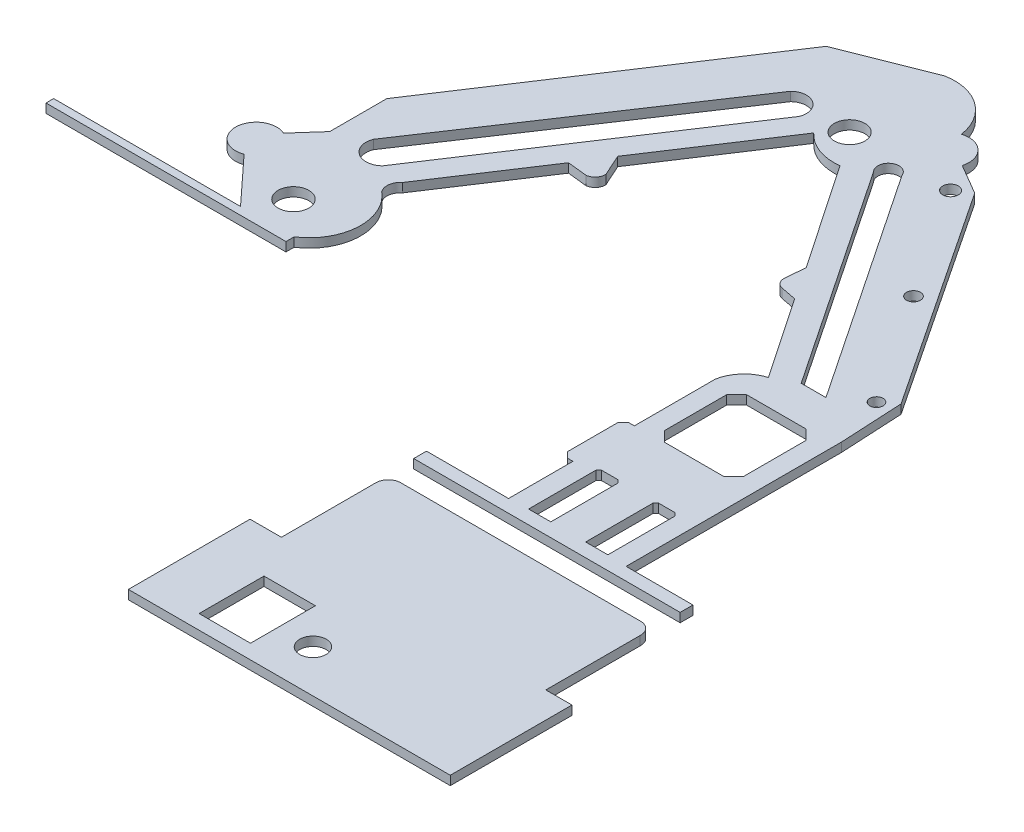
from build123d import *

# Parameters (mm, degrees)
SKETCH4_R             = 0.750267771
SKETCH4_R_2           = 0.265378854
SKETCH4_R_3           = 0.744648083
SKETCH4_R_4           = 0.32969998
SKETCH4_R_5           = 0.283853506
BOSS_EXTRUDE1_DEPTH   = 0.5
SKETCH4_R_6           = 0.632780779
SKETCH4_W             = 2.64350155
SKETCH4_H             = 3.390658061
BOSS_EXTRUDE1_2_DEPTH = 0.5
CUT_EXTRUDE2_START    = -10
CUT_EXTRUDE2_DEPTH    = 10
CUT_EXTRUDE3_START    = -10
SKETCH6_R             = 0.732780779
SKETCH6_R_2           = 0.632780779
SKETCH6_R_3           = 0.850267771
SKETCH6_R_4           = 0.750267771
SKETCH6_R_5           = 0.844648083
SKETCH6_R_6           = 0.744648083
SKETCH6_R_7           = 0.42969998
SKETCH6_R_8           = 0.32969998
SKETCH6_R_9           = 0.365378854
SKETCH6_R_10          = 0.265378854
SKETCH6_W             = 2.84350155
SKETCH6_H             = 3.590658061
SKETCH6_W_2           = 2.64350155
SKETCH6_H_2           = 3.390658061
SKETCH6_R_11          = 0.383853506
SKETCH6_R_12          = 0.283853506
CUT_EXTRUDE3_DEPTH    = 10


with BuildPart() as part:
    # Sketch4 → Boss-Extrude1 (new body)
    with BuildSketch(Plane(origin=(0, 0, 0), x_dir=(1, 0, 0), z_dir=(0, 1, 0))):
        with BuildLine():
            Line((-11.696283574, -2.014082393), (-21.838660036, -2.014082393))
            Line((-21.838660036, -2.014082393), (-21.838660036, -2.737299418))
            Line((-21.838660036, -2.737299418), (-8.267641282, -2.737299418))
            Line((-8.267641282, -2.737299418), (-8.267641282, -2.216070709))
            ThreePointArc((-8.267641282, -2.216070709), (-6.9710726, 0.108801001), (-8.041746829, 2.545966467))
            ThreePointArc((-8.041746829, 2.545966467), (-8.144633072, 2.982775881), (-7.908513733, 3.364398341))
            Line((-7.908513733, 3.364398341), (-4.305242174, 8.839733186))
            Line((-4.305242174, 8.839733186), (-3.299405457, 8.732581616))
            ThreePointArc((-3.299405457, 8.732581616), (-2.807647773, 8.98755206), (-2.639809989, 9.515440329))
            Line((-2.639809989, 9.515440329), (-3.155299637, 10.657283488))
            Line((-3.155299637, 10.657283488), (0.999182594, 16.970207993))
            ThreePointArc((0.999182594, 16.970207993), (2.017035083, 16.351359893), (3.199096829, 16.203960132))
            Line((3.199096829, 16.203960132), (7.062416262, 10.510667533))
            Line((7.062416262, 10.510667533), (6.986470802, 9.529316973))
            ThreePointArc((6.986470802, 9.529316973), (7.088909536, 9.032904845), (7.512361042, 8.754323587))
            Line((7.512361042, 8.754323587), (8.297542954, 8.603970949))
            Line((8.297542954, 8.603970949), (11.203908829, 4.320920683))
            ThreePointArc((11.203908829, 4.320920683), (10.34420923, 3.685817641), (9.894897145, 2.715993984))
            Line((9.894897145, 2.715993984), (9.894897145, -1.633176582))
            Line((9.894897145, -1.633176582), (9.665577443, -1.633176582))
            Line((9.665577443, -1.633176582), (9.280761035, -1.988912184))
            Line((9.280761035, -1.988912184), (9.280761035, -4.912831705))
            Line((9.280761035, -4.912831705), (9.665577443, -5.329106227))
            Line((9.665577443, -5.329106227), (9.894897145, -5.329106227))
            Line((9.894897145, -5.329106227), (9.894897145, -8.590016683))
            Line((9.894897145, -8.590016683), (5.357513848, -8.590016683))
            Line((5.357513848, -8.590016683), (5.357513848, -9.598509545))
            Line((5.357513848, -9.598509545), (20.394810246, -9.598509545))
            Line((20.394810246, -9.598509545), (20.394810246, -8.590016683))
            Line((20.394810246, -8.590016683), (16.696957273, -8.590016683))
            Line((16.696957273, -8.590016683), (16.696957273, 3.188629617))
            Line((16.696957273, 3.188629617), (16.513647646, 6.695111796))
            Line((16.513647646, 6.695111796), (8.419413526, 18.886774693))
            Line((8.419413526, 18.886774693), (6.813548497, 19.827890477))
            ThreePointArc((6.813548497, 19.827890477), (6.445780879, 21.035174164), (5.24174765, 21.413447748))
            ThreePointArc((5.24174765, 21.413447748), (3.999308004, 23.267073464), (1.810059191, 23.699247279))
            Line((1.810059191, 23.699247279), (-2.930027074, 21.821131787))
            Line((-2.930027074, 21.821131787), (-12.623890047, 7.090866568))
            Line((-12.623890047, 7.090866568), (-12.623890047, 3.94718675))
            Line((-12.623890047, 3.94718675), (-13.717599439, 2.715993984))
            ThreePointArc((-13.717599439, 2.715993984), (-15.442222206, 1.544355583), (-13.799219853, 0.2607655))
            Line((-13.799219853, 0.2607655), (-11.696283574, -2.014082393))
        make_face()
        Polygon((15.387945589, -5.012831705), (15.387945589, -8.590016683), (14.359515417, -8.590016683), (14.359515417, -5.012831705), (14.459515417, -4.912831705), (15.287945589, -4.912831705), align=None, mode=Mode.SUBTRACT)
        Polygon((12.232339001, -5.012831705), (12.232339001, -8.590016683), (11.203908829, -8.590016683), (11.203908829, -5.012831705), (11.303908829, -4.912831705), (12.132339001, -4.912831705), align=None, mode=Mode.SUBTRACT)
        with Locations(Location((-10.238001202, -0.352181677, 0), (0, 0, 270))):
            Circle(SKETCH4_R, mode=Mode.SUBTRACT)
        with BuildLine():
            ThreePointArc((-9.448675298, 3.772911532), (-10.488171503, 3.68816485), (-10.80864856, 4.68065103))
            Line((-10.80864856, 4.68065103), (-1.58551386, 18.498730584))
            ThreePointArc((-1.58551386, 18.498730584), (-0.602864551, 18.586331432), (-0.306829257, 17.645248717))
            Line((-0.306829257, 17.645248717), (-9.448675298, 3.772911532))
        make_face(mode=Mode.SUBTRACT)
        with BuildLine():
            Line((12.672348148, 4.971230017), (4.572305297, 17.059398095))
            ThreePointArc((4.572305297, 17.059398095), (4.638532997, 17.816162349), (5.357513848, 17.570918019))
            Line((5.357513848, 17.570918019), (13.800316104, 4.971230017))
            Line((13.800316104, 4.971230017), (12.672348148, 4.971230017))
        make_face(mode=Mode.SUBTRACT)
        Polygon((14.887945589, 2.715993984), (15.387945589, 2.215993984), (15.387945589, -1.133176582), (14.887945589, -1.633176582), (11.703908829, -1.633176582), (11.203908829, -1.133176582), (11.203908829, 2.215993984), (11.703908829, 2.715993984), align=None, mode=Mode.SUBTRACT)
        with Locations(Location((15.603207878, 6.050507476, 0), (0, 0, 270))):
            Circle(SKETCH4_R_2, mode=Mode.SUBTRACT)
        with Locations(Location((1.931063129, 18.237068392, 0), (0, 0, 270))):
            Circle(SKETCH4_R_3, mode=Mode.SUBTRACT)
        with Locations(Location((7.512361042, 18.237068392, 0), (0, 0, 270))):
            Circle(SKETCH4_R_4, mode=Mode.SUBTRACT)
        with Locations(Location((11.55778446, 12.143787934, 0), (0, 0, 270))):
            Circle(SKETCH4_R_5, mode=Mode.SUBTRACT)
    extrude(amount=BOSS_EXTRUDE1_DEPTH)


with BuildPart() as body_2:
    # Sketch4 → Boss-Extrude1 2 (new body)
    with BuildSketch(Plane(origin=(0, 0, 0), x_dir=(1, 0, 0), z_dir=(0, 1, 0))):
        with BuildLine():
            Line((19.613108594, -10.815832828), (6.267197301, -10.815832828))
            ThreePointArc((6.267197301, -10.815832828), (5.68414714, -11.098078534), (5.47144627, -11.70993511))
            Line((5.47144627, -11.70993511), (5.47144627, -16.728123553))
            Line((5.47144627, -16.728123553), (3.736597162, -16.728123553))
            Line((3.736597162, -16.728123553), (3.736597162, -23.756096292))
            Line((3.736597162, -23.756096292), (21.838660036, -23.756096292))
            Line((21.838660036, -23.756096292), (21.838660036, -16.728123553))
            Line((21.838660036, -16.728123553), (20.394183639, -16.728123553))
            Line((20.394183639, -16.728123553), (20.394183639, -11.660759485))
            ThreePointArc((20.394183639, -11.660759485), (20.178636157, -11.076530218), (19.613108594, -10.815832828))
        make_face()
        with Locations(Location((11.741164301, -21.25357645, 0), (0, 0, 270))):
            Circle(SKETCH4_R_6, mode=Mode.SUBTRACT)
        with Locations((8.419413526, -21.012384273)):
            Rectangle(SKETCH4_W, SKETCH4_H, mode=Mode.SUBTRACT)
    extrude(amount=BOSS_EXTRUDE1_2_DEPTH)


with BuildPart() as cut_extrude2_tool:
    # Sketch5 → Cut-Extrude2 (new body)
    # profile 1 of 2: a face of its own
    with BuildSketch(Plane(origin=(0, 0.5, 0), x_dir=(1, 0, 0), z_dir=(0, 1, 0)).offset(CUT_EXTRUDE2_START)):
        with BuildLine():
            Line((20.394183639, -16.728123553), (20.394183639, -11.660759485))
            ThreePointArc((20.394183639, -11.660759485), (20.178636157, -11.076530218), (19.613108594, -10.815832828))
            Line((19.613108594, -10.815832828), (6.267197301, -10.815832828))
            ThreePointArc((6.267197301, -10.815832828), (5.68414714, -11.098078534), (5.47144627, -11.70993511))
            Line((5.47144627, -11.70993511), (5.47144627, -16.728123553))
            Line((5.47144627, -16.728123553), (3.736597162, -16.728123553))
            Line((3.736597162, -16.728123553), (3.736597162, -23.756096292))
            Line((3.736597162, -23.756096292), (21.838660036, -23.756096292))
            Line((21.838660036, -23.756096292), (21.838660036, -16.728123553))
            Line((21.838660036, -16.728123553), (20.394183639, -16.728123553))
        make_face()
        with BuildLine():
            Line((20.244183639, -16.878123553), (20.244183639, -11.657665517))
            ThreePointArc((20.244183639, -11.657665517), (20.070382374, -11.18040847), (19.610014627, -10.965832828))
            Line((19.610014627, -10.965832828), (6.271771424, -10.965832828))
            ThreePointArc((6.271771424, -10.965832828), (5.79344755, -11.200910159), (5.62144627, -11.705360988))
            Line((5.62144627, -11.705360988), (5.62144627, -16.878123553))
            Line((5.62144627, -16.878123553), (3.886597162, -16.878123553))
            Line((3.886597162, -16.878123553), (3.886597162, -23.606096292))
            Line((3.886597162, -23.606096292), (21.688660036, -23.606096292))
            Line((21.688660036, -23.606096292), (21.688660036, -16.878123553))
            Line((21.688660036, -16.878123553), (20.244183639, -16.878123553))
        make_face(mode=Mode.SUBTRACT)
    # profile 2 of 2: a face of its own
    with BuildSketch(Plane(origin=(0, 0.5, 0), x_dir=(1, 0, 0), z_dir=(0, 1, 0)).offset(CUT_EXTRUDE2_START)):
        with BuildLine():
            Line((9.894897145, -5.329106227), (9.894897145, -8.590016683))
            Line((9.894897145, -8.590016683), (5.357513848, -8.590016683))
            Line((5.357513848, -8.590016683), (5.357513848, -9.598509545))
            Line((5.357513848, -9.598509545), (20.394810246, -9.598509545))
            Line((20.394810246, -9.598509545), (20.394810246, -8.590016683))
            Line((20.394810246, -8.590016683), (16.696957273, -8.590016683))
            Line((16.696957273, -8.590016683), (16.696957273, 3.188629617))
            Line((16.696957273, 3.188629617), (16.513647646, 6.695111796))
            Line((16.513647646, 6.695111796), (8.419413526, 18.886774693))
            Line((8.419413526, 18.886774693), (6.813548497, 19.827890477))
            ThreePointArc((6.813548497, 19.827890477), (6.445780879, 21.035174164), (5.24174765, 21.413447748))
            ThreePointArc((5.24174765, 21.413447748), (3.999308004, 23.267073464), (1.810059191, 23.699247279))
            Line((1.810059191, 23.699247279), (-2.930027074, 21.821131787))
            Line((-2.930027074, 21.821131787), (-12.623890047, 7.090866568))
            Line((-12.623890047, 7.090866568), (-12.623890047, 3.94718675))
            Line((-12.623890047, 3.94718675), (-13.717599439, 2.715993984))
            ThreePointArc((-13.717599439, 2.715993984), (-15.442222206, 1.544355583), (-13.799219853, 0.2607655))
            Line((-13.799219853, 0.2607655), (-11.696283574, -2.014082393))
            Line((-11.696283574, -2.014082393), (-21.838660036, -2.014082393))
            Line((-21.838660036, -2.014082393), (-21.838660036, -2.737299418))
            Line((-21.838660036, -2.737299418), (-8.267641282, -2.737299418))
            Line((-8.267641282, -2.737299418), (-8.267641282, -2.216070709))
            ThreePointArc((-8.267641282, -2.216070709), (-6.9710726, 0.108801001), (-8.041746829, 2.545966467))
            ThreePointArc((-8.041746829, 2.545966467), (-8.144633072, 2.982775881), (-7.908513733, 3.364398341))
            Line((-7.908513733, 3.364398341), (-4.305242174, 8.839733186))
            Line((-4.305242174, 8.839733186), (-3.299405457, 8.732581616))
            ThreePointArc((-3.299405457, 8.732581616), (-2.807647773, 8.98755206), (-2.639809989, 9.515440329))
            Line((-2.639809989, 9.515440329), (-3.155299637, 10.657283488))
            Line((-3.155299637, 10.657283488), (0.999182594, 16.970207993))
            ThreePointArc((0.999182594, 16.970207993), (2.017035083, 16.351359893), (3.199096829, 16.203960132))
            Line((3.199096829, 16.203960132), (7.062416262, 10.510667533))
            Line((7.062416262, 10.510667533), (6.986470802, 9.529316973))
            ThreePointArc((6.986470802, 9.529316973), (7.088909536, 9.032904845), (7.512361042, 8.754323587))
            Line((7.512361042, 8.754323587), (8.297542954, 8.603970949))
            Line((8.297542954, 8.603970949), (11.203908829, 4.320920683))
            ThreePointArc((11.203908829, 4.320920683), (10.34420923, 3.685817641), (9.894897145, 2.715993984))
            Line((9.894897145, 2.715993984), (9.894897145, -1.633176582))
            Line((9.894897145, -1.633176582), (9.665577443, -1.633176582))
            Line((9.665577443, -1.633176582), (9.280761035, -1.988912184))
            Line((9.280761035, -1.988912184), (9.280761035, -4.912831705))
            Line((9.280761035, -4.912831705), (9.665577443, -5.329106227))
            Line((9.665577443, -5.329106227), (9.894897145, -5.329106227))
        make_face()
        with BuildLine():
            Line((10.044897145, -5.179106227), (10.044897145, -8.740016683))
            Line((10.044897145, -8.740016683), (5.507513848, -8.740016683))
            Line((5.507513848, -8.740016683), (5.507513848, -9.448509545))
            Line((5.507513848, -9.448509545), (20.244810246, -9.448509545))
            Line((20.244810246, -9.448509545), (20.244810246, -8.740016683))
            Line((20.244810246, -8.740016683), (16.546957273, -8.740016683))
            Line((16.546957273, -8.740016683), (16.546957273, 3.184711491))
            Line((16.546957273, 3.184711491), (16.365993628, 6.646317993))
            Line((16.365993628, 6.646317993), (8.313637636, 18.774903394))
            Line((8.313637636, 18.774903394), (6.642100878, 19.754506037))
            ThreePointArc((6.642100878, 19.754506037), (6.322304084, 20.946333695), (5.121156655, 21.229119847))
            ThreePointArc((5.121156655, 21.229119847), (3.98633999, 23.093904553), (1.852600254, 23.554757679))
            Line((1.852600254, 23.554757679), (-2.830754532, 21.699120315))
            Line((-2.830754532, 21.699120315), (-12.473890047, 7.045937773))
            Line((-12.473890047, 7.045937773), (-12.473890047, 3.890183505))
            Line((-12.473890047, 3.890183505), (-13.675897608, 2.537079084))
            ThreePointArc((-13.675897608, 2.537079084), (-15.292141792, 1.543998988), (-13.754390782, 0.433244663))
            Line((-13.754390782, 0.433244663), (-11.353345282, -2.164082393))
            Line((-11.353345282, -2.164082393), (-21.688660036, -2.164082393))
            Line((-21.688660036, -2.164082393), (-21.688660036, -2.587299418))
            Line((-21.688660036, -2.587299418), (-8.417641282, -2.587299418))
            Line((-8.417641282, -2.587299418), (-8.417641282, -2.135708192))
            ThreePointArc((-8.417641282, -2.135708192), (-7.122504541, 0.0855942), (-8.151420666, 2.442052368))
            ThreePointArc((-8.151420666, 2.442052368), (-8.296245408, 2.982419388), (-8.019499448, 3.468611114))
            Line((-8.019499448, 3.468611114), (-4.380276751, 8.998575347))
            Line((-4.380276751, 8.998575347), (-3.298731155, 8.883358526))
            ThreePointArc((-3.298731155, 8.883358526), (-2.925808152, 9.080147199), (-2.78773844, 9.478561684))
            Line((-2.78773844, 9.478561684), (-3.325976175, 10.670793342))
            Line((-3.325976175, 10.670793342), (0.975596103, 17.207227858))
            ThreePointArc((0.975596103, 17.207227858), (2.022674542, 16.508657782), (3.272865989, 16.362388331))
            Line((3.272865989, 16.362388331), (7.216020448, 10.551444535))
            Line((7.216020448, 10.551444535), (7.13533331, 9.508823062))
            ThreePointArc((7.13533331, 9.508823062), (7.210834119, 9.120394319), (7.540571639, 8.901646912))
            Line((7.540571639, 8.901646912), (8.386776871, 8.739609062))
            Line((8.386776871, 8.739609062), (11.437155352, 4.244330447))
            ThreePointArc((11.437155352, 4.244330447), (10.525922488, 3.667301963), (10.044897145, 2.701940981))
            Line((10.044897145, 2.701940981), (10.044897145, -1.783176582))
            Line((10.044897145, -1.783176582), (9.724288126, -1.783176582))
            Line((9.724288126, -1.783176582), (9.430761035, -2.054521656))
            Line((9.430761035, -2.054521656), (9.430761035, -4.854121022))
            Line((9.430761035, -4.854121022), (9.731186914, -5.179106227))
            Line((9.731186914, -5.179106227), (10.044897145, -5.179106227))
        make_face(mode=Mode.SUBTRACT)
    extrude(amount=CUT_EXTRUDE2_DEPTH)


with BuildPart() as part_1:
    add(part.part)

    # Cut-Extrude2: cut by cut_extrude2_tool
    add(cut_extrude2_tool.part, mode=Mode.SUBTRACT)


with BuildPart() as body_2_1:
    add(body_2.part)

    # Cut-Extrude2: cut by cut_extrude2_tool
    add(cut_extrude2_tool.part, mode=Mode.SUBTRACT)


with BuildPart() as cut_extrude3_tool:
    # Sketch6 → Cut-Extrude3 (new body)
    # profile 1 of 12: a face of its own
    with BuildSketch(Plane(origin=(0, 0.5, 0), x_dir=(1, 0, 0), z_dir=(0, 1, 0)).offset(CUT_EXTRUDE3_START)):
        with Locations(Location((11.741164301, -21.25357645, 0), (0, 0, 270))):
            Circle(SKETCH6_R)
        with Locations((11.741164301, -21.25357645)):
            Circle(SKETCH6_R_2, mode=Mode.SUBTRACT)
    # profile 2 of 12: a face of its own
    with BuildSketch(Plane(origin=(0, 0.5, 0), x_dir=(1, 0, 0), z_dir=(0, 1, 0)).offset(CUT_EXTRUDE3_START)):
        with Locations(Location((-10.238001202, -0.352181677, 0), (0, 0, 270))):
            Circle(SKETCH6_R_3)
        with Locations((-10.238001202, -0.352181677)):
            Circle(SKETCH6_R_4, mode=Mode.SUBTRACT)
    # profile 3 of 12: a face of its own
    with BuildSketch(Plane(origin=(0, 0.5, 0), x_dir=(1, 0, 0), z_dir=(0, 1, 0)).offset(CUT_EXTRUDE3_START)):
        with Locations(Location((1.931063129, 18.237068392, 0), (0, 0, 270))):
            Circle(SKETCH6_R_5)
        with Locations((1.931063129, 18.237068392)):
            Circle(SKETCH6_R_6, mode=Mode.SUBTRACT)
    # profile 4 of 12: a face of its own
    with BuildSketch(Plane(origin=(0, 0.5, 0), x_dir=(1, 0, 0), z_dir=(0, 1, 0)).offset(CUT_EXTRUDE3_START)):
        with Locations(Location((7.512361042, 18.237068392, 0), (0, 0, 270))):
            Circle(SKETCH6_R_7)
        with Locations((7.512361042, 18.237068392)):
            Circle(SKETCH6_R_8, mode=Mode.SUBTRACT)
    # profile 5 of 12: a face of its own
    with BuildSketch(Plane(origin=(0, 0.5, 0), x_dir=(1, 0, 0), z_dir=(0, 1, 0)).offset(CUT_EXTRUDE3_START)):
        with Locations(Location((15.603207878, 6.050507476, 0), (0, 0, 270))):
            Circle(SKETCH6_R_9)
        with Locations((15.603207878, 6.050507476)):
            Circle(SKETCH6_R_10, mode=Mode.SUBTRACT)
    # profile 6 of 12: a face of its own
    with BuildSketch(Plane(origin=(0, 0.5, 0), x_dir=(1, 0, 0), z_dir=(0, 1, 0)).offset(CUT_EXTRUDE3_START)):
        with Locations((8.419413526, -21.012384273)):
            Rectangle(SKETCH6_W, SKETCH6_H)
        with Locations((8.419413526, -21.012384273)):
            Rectangle(SKETCH6_W_2, SKETCH6_H_2, mode=Mode.SUBTRACT)
    # profile 7 of 12: a face of its own
    with BuildSketch(Plane(origin=(0, 0.5, 0), x_dir=(1, 0, 0), z_dir=(0, 1, 0)).offset(CUT_EXTRUDE3_START)):
        with BuildLine():
            Line((-0.217706741, 17.598755635), (-9.371537009, 3.708232929))
            ThreePointArc((-9.371537009, 3.708232929), (-10.54356033, 3.604905623), (-10.89807984, 4.726792923))
            Line((-10.89807984, 4.726792923), (-1.662854791, 18.562986211))
            ThreePointArc((-1.662854791, 18.562986211), (-0.547475663, 18.669590616), (-0.217706741, 17.598755635))
        make_face()
        with BuildLine():
            Line((-0.306829257, 17.645248717), (-9.448675298, 3.772911532))
            ThreePointArc((-9.448675298, 3.772911532), (-10.488171503, 3.68816485), (-10.80864856, 4.68065103))
            Line((-10.80864856, 4.68065103), (-1.58551386, 18.498730584))
            ThreePointArc((-1.58551386, 18.498730584), (-0.602864551, 18.586331432), (-0.306829257, 17.645248717))
        make_face(mode=Mode.SUBTRACT)
    # profile 8 of 12: a face of its own
    with BuildSketch(Plane(origin=(0, 0.5, 0), x_dir=(1, 0, 0), z_dir=(0, 1, 0)).offset(CUT_EXTRUDE3_START)):
        with BuildLine():
            Line((12.618981444, 4.871230017), (13.98769886, 4.871230017))
            Line((13.98769886, 4.871230017), (5.447367138, 17.616466951))
            ThreePointArc((5.447367138, 17.616466951), (4.583373022, 17.899575591), (4.495313876, 16.994654643))
            Line((4.495313876, 16.994654643), (12.618981444, 4.871230017))
        make_face()
        with BuildLine():
            Line((12.672348148, 4.971230017), (13.800316104, 4.971230017))
            Line((13.800316104, 4.971230017), (5.357513848, 17.570918019))
            ThreePointArc((5.357513848, 17.570918019), (4.638532997, 17.816162349), (4.572305297, 17.059398095))
            Line((4.572305297, 17.059398095), (12.672348148, 4.971230017))
        make_face(mode=Mode.SUBTRACT)
    # profile 9 of 12: a face of its own
    with BuildSketch(Plane(origin=(0, 0.5, 0), x_dir=(1, 0, 0), z_dir=(0, 1, 0)).offset(CUT_EXTRUDE3_START)):
        with Locations(Location((11.55778446, 12.143787934, 0), (0, 0, 270))):
            Circle(SKETCH6_R_11)
        with Locations((11.55778446, 12.143787934)):
            Circle(SKETCH6_R_12, mode=Mode.SUBTRACT)
    # profile 10 of 12: a face of its own
    with BuildSketch(Plane(origin=(0, 0.5, 0), x_dir=(1, 0, 0), z_dir=(0, 1, 0)).offset(CUT_EXTRUDE3_START)):
        Polygon((15.487945589, -1.174597939), (14.929366945, -1.733176582), (11.662487473, -1.733176582), (11.103908829, -1.174597939), (11.103908829, 2.25741534), (11.662487473, 2.815993984), (14.929366945, 2.815993984), (15.487945589, 2.25741534), align=None)
        Polygon((15.387945589, -1.133176582), (14.887945589, -1.633176582), (11.703908829, -1.633176582), (11.203908829, -1.133176582), (11.203908829, 2.215993984), (11.703908829, 2.715993984), (14.887945589, 2.715993984), (15.387945589, 2.215993984), align=None, mode=Mode.SUBTRACT)
    # profile 11 of 12: a face of its own
    with BuildSketch(Plane(origin=(0, 0.5, 0), x_dir=(1, 0, 0), z_dir=(0, 1, 0)).offset(CUT_EXTRUDE3_START)):
        Polygon((14.418094061, -4.812831705), (14.259515417, -4.971410349), (14.259515417, -8.690016683), (15.487945589, -8.690016683), (15.487945589, -4.971410349), (15.329366945, -4.812831705), align=None)
        Polygon((14.459515417, -4.912831705), (14.359515417, -5.012831705), (14.359515417, -8.590016683), (15.387945589, -8.590016683), (15.387945589, -5.012831705), (15.287945589, -4.912831705), align=None, mode=Mode.SUBTRACT)
    # profile 12 of 12: a face of its own
    with BuildSketch(Plane(origin=(0, 0.5, 0), x_dir=(1, 0, 0), z_dir=(0, 1, 0)).offset(CUT_EXTRUDE3_START)):
        Polygon((12.332339001, -8.690016683), (11.103908829, -8.690016683), (11.103908829, -4.971410349), (11.262487473, -4.812831705), (12.173760357, -4.812831705), (12.332339001, -4.971410349), align=None)
        Polygon((12.232339001, -8.590016683), (11.203908829, -8.590016683), (11.203908829, -5.012831705), (11.303908829, -4.912831705), (12.132339001, -4.912831705), (12.232339001, -5.012831705), align=None, mode=Mode.SUBTRACT)
    extrude(amount=CUT_EXTRUDE3_DEPTH)


with BuildPart() as part_2:
    add(part_1.part)

    # Cut-Extrude3: cut by cut_extrude3_tool
    add(cut_extrude3_tool.part, mode=Mode.SUBTRACT)


with BuildPart() as body_2_2:
    add(body_2_1.part)

    # Cut-Extrude3: cut by cut_extrude3_tool
    add(cut_extrude3_tool.part, mode=Mode.SUBTRACT)


solid = Compound([part_2.part, body_2_2.part])
